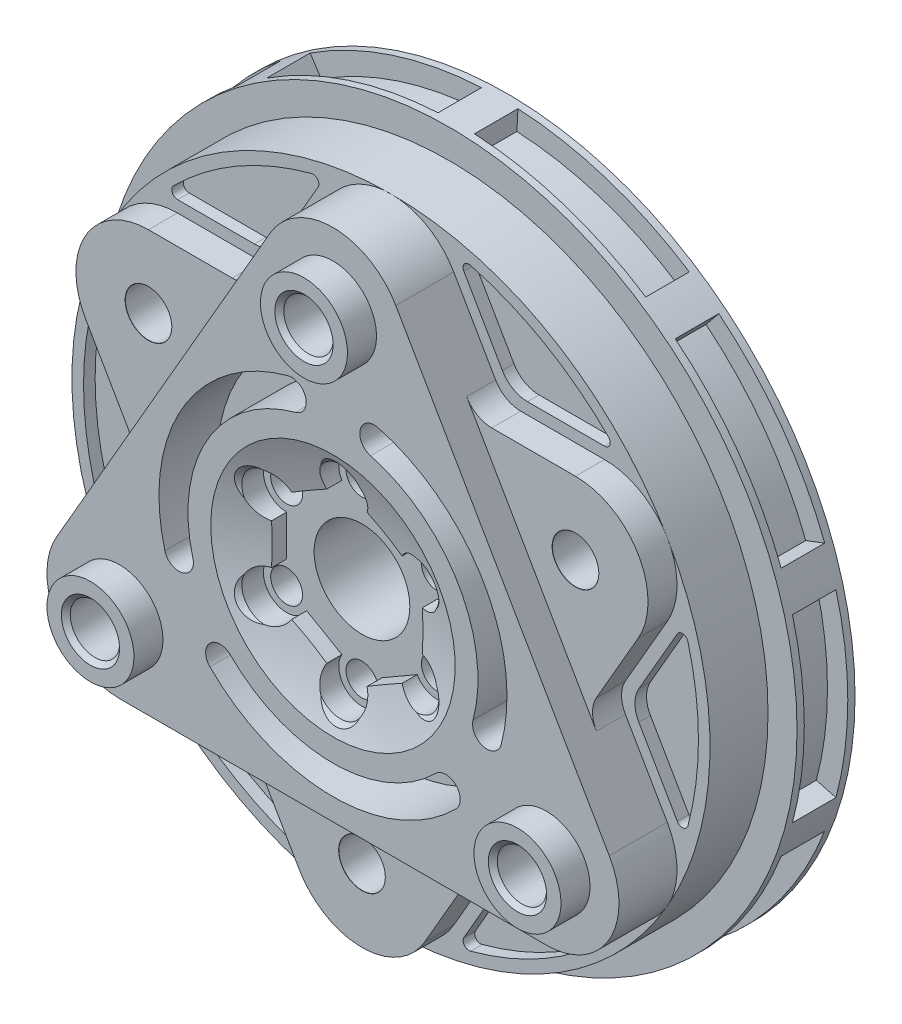
from build123d import *
from build123d.topology import SkipClean

# Parameters (mm, degrees)
SKETCH1_R                          = 60
BOSS_EXTRUDE1_DEPTH                = 10
SKETCH1_3_R                        = 55
BOSS_EXTRUDE2_DEPTH                = 20
BOSS_EXTRUDE3_DEPTH                = 30
BOSS_EXTRUDE4_START                = 20
BOSS_EXTRUDE4_DEPTH                = 5
CUT_EXTRUDE1_DEPTH                 = 5
SKETCH3_R                          = 8.25
CUT_EXTRUDE2_DEPTH                 = 89.45903
CBORE_FOR_M5_SBHCS1_AT_2_COUNT     = 2
CBORE_FOR_M5_SBHCS1_AT_2_PITCH     = 15
CBORE_FOR_M5_SBHCS1_AT_3_COUNT     = 2
CBORE_FOR_M5_SBHCS1_AT_3_PITCH     = 25.980762
CBORE_FOR_M5_SBHCS1_AT_4_COUNT     = 2
CBORE_FOR_M5_SBHCS1_AT_4_PITCH     = 30
CBORE_FOR_M5_SBHCS1_AT_5_COUNT     = 2
CBORE_FOR_M5_SBHCS1_AT_5_PITCH     = 25.980762
CBORE_FOR_M5_SBHCS1_AT_6_COUNT     = 2
CBORE_FOR_M5_SBHCS1_AT_6_PITCH     = 15
SKETCH7_R                          = 7.5
BOSS_EXTRUDE5_DEPTH                = 5
M10X1_5_TAPPED_HOLE1_D             = 8.5
M10X1_5_TAPPED_HOLE1_DEPTH         = 22.446342
M10X1_5_TAPPED_HOLE1_CSINK_D       = 10.05
M10X1_5_TAPPED_HOLE1_CSINK_ANGLE   = 90
M10X1_5_TAPPED_HOLE1_TIP           = 2.553658
CUT_EXTRUDE3_DEPTH                 = 10
CIRPATTERN1_COUNT                  = 3
F_8_0_8_DIAMETER_HOLE2_D           = 8
F_8_0_8_DIAMETER_HOLE2_CSINK_D     = 8.05
F_8_0_8_DIAMETER_HOLE2_CSINK_ANGLE = 90
CUT_EXTRUDE4_DEPTH                 = 2
FILLET1_R                          = 5
CIRPATTERN2_COUNT                  = 6
FILLET1_OF_CIRPATTERN2_R           = 5
FILLET2_R                          = 5
CUT_EXTRUDE7_DEPTH                 = 3.75
CIRPATTERN3_COUNT                  = 10


with BuildPart() as part:
    # Sketch1 → Boss-Extrude1 (new body)
    with BuildSketch(Plane.XY):
        Circle(SKETCH1_R)
    extrude(amount=BOSS_EXTRUDE1_DEPTH)

    # Sketch1<3> → Boss-Extrude2 (add)
    with BuildSketch(Plane.XY):
        Circle(SKETCH1_3_R)
    extrude(amount=BOSS_EXTRUDE2_DEPTH)

    # Sketch1<4> → Boss-Extrude3 (add)
    with BuildSketch(Plane.XY):
        with BuildLine():
            Line((-10.825318, 48.75), (-47.631397, -15))
            ThreePointArc((-47.631397, -15), (-47.631397, -27.5), (-36.80608, -33.75))
            Line((-36.80608, -33.75), (36.80608, -33.75))
            ThreePointArc((36.80608, -33.75), (47.631397, -27.5), (47.631397, -15))
            Line((47.631397, -15), (10.825318, 48.75))
            ThreePointArc((10.825318, 48.75), (0, 55), (-10.825318, 48.75))
        make_face()
    extrude(amount=BOSS_EXTRUDE3_DEPTH)

    # Sketch1<5> → Boss-Extrude4 (add)
    with BuildSketch(Plane.XY.offset(BOSS_EXTRUDE4_START)):
        with BuildLine():
            Line((36.80608, 33.75), (-36.80608, 33.75))
            ThreePointArc((-36.80608, 33.75), (-47.631397, 27.5), (-47.631397, 15))
            Line((-47.631397, 15), (-10.825318, -48.75))
            ThreePointArc((-10.825318, -48.75), (0, -55), (10.825318, -48.75))
            Line((10.825318, -48.75), (47.631397, 15))
            ThreePointArc((47.631397, 15), (47.631397, 27.5), (36.80608, 33.75))
        make_face()
    extrude(amount=BOSS_EXTRUDE4_DEPTH)

    # Sketch2 → Cut-Extrude1 (cut)
    with BuildSketch(Plane.XY.offset(30)):
        Polygon((0, 15), (-12.990381, 7.5), (-12.990381, -7.5), (0, -15), (12.990381, -7.5), (12.990381, 7.5), align=None)
    extrude(amount=-CUT_EXTRUDE1_DEPTH, mode=Mode.SUBTRACT)

    # Sketch3 → Cut-Extrude2 (cut, through all)
    with BuildSketch(Plane.XY.offset(25)):
        Circle(SKETCH3_R)
    extrude(amount=-CUT_EXTRUDE2_DEPTH, mode=Mode.SUBTRACT)

    # Sketch5 → CBORE for M5 SBHCS1 (revolve, cut)
    with BuildSketch(Plane(origin=(0, 15, 30), x_dir=(0, -1, 0), z_dir=(1, 0, 0))):
        Polygon((0, 0), (0, 30), (2.75, 30), (2.75, 5), (4, 5), (4, 1.275), (5.275, 0), align=None)
    cbore_for_m5_sbhcs1 = revolve(axis=Axis((0, 15, 36.35), (0, 0, -1)), mode=Mode.SUBTRACT)

    # CBORE for M5 SBHCS1 at 2: CBORE for M5 SBHCS1 ×2
    with Locations(*[Vector(0.8660254037844387, -0.49999999999999994, 0) * (i * CBORE_FOR_M5_SBHCS1_AT_2_PITCH) for i in range(1, CBORE_FOR_M5_SBHCS1_AT_2_COUNT)]):
        add(cbore_for_m5_sbhcs1, mode=Mode.SUBTRACT)

    # CBORE for M5 SBHCS1 at 3: CBORE for M5 SBHCS1 ×2
    with Locations(*[Vector(0.4999999999999999, -0.8660254037844388, 0) * (i * CBORE_FOR_M5_SBHCS1_AT_3_PITCH) for i in range(1, CBORE_FOR_M5_SBHCS1_AT_3_COUNT)]):
        add(cbore_for_m5_sbhcs1, mode=Mode.SUBTRACT)

    # CBORE for M5 SBHCS1 at 4: CBORE for M5 SBHCS1 ×2
    with Locations(*[(0, -i * CBORE_FOR_M5_SBHCS1_AT_4_PITCH, 0) for i in range(1, CBORE_FOR_M5_SBHCS1_AT_4_COUNT)]):
        add(cbore_for_m5_sbhcs1, mode=Mode.SUBTRACT)

    # CBORE for M5 SBHCS1 at 5: CBORE for M5 SBHCS1 ×2
    with Locations(*[Vector(-0.5, -0.8660254037844387, 0) * (i * CBORE_FOR_M5_SBHCS1_AT_5_PITCH) for i in range(1, CBORE_FOR_M5_SBHCS1_AT_5_COUNT)]):
        add(cbore_for_m5_sbhcs1, mode=Mode.SUBTRACT)

    # CBORE for M5 SBHCS1 at 6: CBORE for M5 SBHCS1 ×2
    with Locations(*[Vector(-0.8660254037844389, -0.4999999999999996, 0) * (i * CBORE_FOR_M5_SBHCS1_AT_6_PITCH) for i in range(1, CBORE_FOR_M5_SBHCS1_AT_6_COUNT)]):
        add(cbore_for_m5_sbhcs1, mode=Mode.SUBTRACT)

    # Sketch6 → Cut-Revolve1 (revolve, cut)
    with SkipClean():  # the faces are left unmerged after this step: merging them gives an invalid solid
        with BuildSketch(Plane(origin=(0, 0, 0), x_dir=(0, 0, -1), z_dir=(1, 0, 0))):
            with BuildLine():
                Line((-54.575252, 49.69516), (-54.636346, -49.730669))
                ThreePointArc((-54.636346, -49.730669), (-26.000011, -0.035332), (-54.575252, 49.69516))
            make_face()
        revolve(axis=Axis((0, 37.754994, 83.5), (0, -1, 0)), mode=Mode.SUBTRACT)

    # Sketch7 → Boss-Extrude5 (add)
    with SkipClean():  # the faces are left unmerged after this step: merging them gives an invalid solid
        with BuildSketch(Plane.XY.offset(30)):
            with Locations(Location((0, 42.5, 0), (0, 0, 180))):
                Circle(SKETCH7_R)
            with Locations(Location((-36.80608, -21.25, 0), (0, 0, 180))):
                Circle(SKETCH7_R)
            with Locations(Location((36.80608, -21.25, 0), (0, 0, 180))):
                Circle(SKETCH7_R)
        extrude(amount=BOSS_EXTRUDE5_DEPTH)

    # M10x1.5 Tapped Hole1
    with Locations(Plane.XY.offset(35)):
        with Locations((-36.80608, -21.25), (0, 42.5), (36.80608, -21.25)):
            CounterSinkHole(M10X1_5_TAPPED_HOLE1_D / 2, M10X1_5_TAPPED_HOLE1_CSINK_D / 2, depth=M10X1_5_TAPPED_HOLE1_DEPTH, counter_sink_angle=M10X1_5_TAPPED_HOLE1_CSINK_ANGLE)
            with Locations((0, 0, -(M10X1_5_TAPPED_HOLE1_DEPTH + M10X1_5_TAPPED_HOLE1_TIP / 2))):  # 118° drill point
                Cone(0, M10X1_5_TAPPED_HOLE1_D / 2, M10X1_5_TAPPED_HOLE1_TIP, mode=Mode.SUBTRACT)

    # Sketch10 → Cut-Extrude3 (cut)
    with SkipClean():  # the faces are left unmerged after this step: merging them gives an invalid solid
        with BuildSketch(Plane.XY.offset(30)):
            with BuildLine():
                ThreePointArc((28.977775, -7.764571), (25.980762, 15), (7.764571, 28.977775))
                ThreePointArc((7.764571, 28.977775), (4.702709, 27.210008), (6.470476, 24.148146))
                ThreePointArc((6.470476, 24.148146), (21.650635, 12.5), (24.148146, -6.470476))
                ThreePointArc((24.148146, -6.470476), (25.915913, -9.532338), (28.977775, -7.764571))
            make_face()
        cut_extrude3 = extrude(amount=-CUT_EXTRUDE3_DEPTH, mode=Mode.SUBTRACT)

    # CirPattern1: Cut-Extrude3 ×3 about axis
    with SkipClean():  # the faces are left unmerged after this step: merging them gives an invalid solid
        cirpattern1_axis = Axis((0, 0, 0), (0, 0, 1))
        for i in range(1, CIRPATTERN1_COUNT):
            add(cut_extrude3.rotate(cirpattern1_axis, i * 360 / CIRPATTERN1_COUNT), mode=Mode.SUBTRACT)

    # Ø8.0 (8) Diameter Hole2 (through all)
    with Locations(Plane.XY.offset(25)):
        with Locations((-36.80608, 21.25), (0, -42.5), (36.80608, 21.25)):
            CounterSinkHole(F_8_0_8_DIAMETER_HOLE2_D / 2, F_8_0_8_DIAMETER_HOLE2_CSINK_D / 2, counter_sink_angle=F_8_0_8_DIAMETER_HOLE2_CSINK_ANGLE)

    # Sketch15 → Cut-Extrude4 (cut)
    with SkipClean():  # the faces are left unmerged after this step: merging them gives an invalid solid
        with BuildSketch(Plane.XY.offset(20)):
            with BuildLine():
                ThreePointArc((-51.186769, 13.744623), (-50.351244, 14.47677), (-49.354956, 13.985291))
                Line((-49.354956, 13.985291), (-41.280544, 0))
                Line((-41.280544, 0), (-49.354956, -13.985291))
                ThreePointArc((-49.354956, -13.985291), (-50.351244, -14.47677), (-51.186769, -13.744623))
                ThreePointArc((-51.186769, -13.744623), (-53, 0), (-51.186769, 13.744623))
            make_face()
        cut_extrude4 = extrude(amount=-CUT_EXTRUDE4_DEPTH, mode=Mode.SUBTRACT)

    # Fillet1
    fillet1_edges = [part.edges().sort_by_distance(p)[0] for p in [
        (-41.280544, 0, 19),
    ]]
    fillet(fillet1_edges, radius=FILLET1_R)

    # CirPattern2: Cut-Extrude4 ×6 about axis
    with SkipClean():  # the faces are left unmerged after this step: merging them gives an invalid solid
        cirpattern2_axis = Axis((0, 0, 0), (0, 0, 1))
        for i in range(1, CIRPATTERN2_COUNT):
            add(cut_extrude4.rotate(cirpattern2_axis, i * 360 / CIRPATTERN2_COUNT), mode=Mode.SUBTRACT)

    # Fillet1 of CirPattern2
    fillet1_of_cirpattern2_edges = [part.edges().sort_by_distance(p)[0] for p in [
        (-20.640272, -35.75, 19),
        (20.640272, -35.75, 19),
        (41.280544, 0, 19),
        (20.640272, 35.75, 19),
        (-20.640272, 35.75, 19),
    ]]
    fillet(fillet1_of_cirpattern2_edges, radius=FILLET1_OF_CIRPATTERN2_R)

    # Fillet2
    fillet2_edges = [part.edges().sort_by_distance(p)[0] for p in [
        (38.971143, 0, 22.5),
        (19.485572, 33.75, 22.5),
        (-19.485572, -33.75, 22.5),
        (-19.485572, 33.75, 22.5),
        (-38.971143, 0, 22.5),
        (19.485572, -33.75, 22.5),
    ]]
    fillet(fillet2_edges, radius=FILLET2_R)

    # Sketch16 → Cut-Extrude7 (cut, symmetric)
    with SkipClean():  # the faces are left unmerged after this step: merging them gives an invalid solid
        with BuildSketch(Plane.XY.offset(5)):
            with BuildLine():
                Line((54.574809, 14.623276), (57.95555, 15.529143))
                ThreePointArc((57.95555, 15.529143), (60, 0), (57.95555, -15.529143))
                Line((57.95555, -15.529143), (54.574809, -14.623276))
                ThreePointArc((54.574809, -14.623276), (56.5, 0), (54.574809, 14.623276))
            make_face()
        cut_extrude7 = extrude(amount=CUT_EXTRUDE7_DEPTH, both=True, mode=Mode.SUBTRACT)

    # CirPattern3: Cut-Extrude7 ×10 about axis
    with SkipClean():  # the faces are left unmerged after this step: merging them gives an invalid solid
        cirpattern3_axis = Axis((0, 0, 0), (0, 0, 1))
        for i in range(1, CIRPATTERN3_COUNT):
            add(cut_extrude7.rotate(cirpattern3_axis, i * 360 / CIRPATTERN3_COUNT), mode=Mode.SUBTRACT)


solid = part.part
